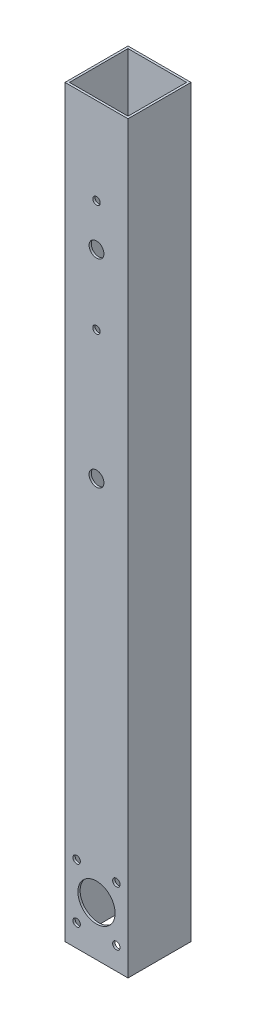
from build123d import *

# Parameters (mm, degrees)
SKETCH1_W           = 25.4
SKETCH1_H           = 25.4
SKETCH1_W_2         = 23.6
SKETCH1_H_2         = 23.6
BOSS_EXTRUDE1_DEPTH = 300
SKETCH2_R           = 7.5
CUT_EXTRUDE1_DEPTH  = 25.4
SKETCH3_R           = 3
CUT_EXTRUDE2_DEPTH  = 25.4
SKETCH4_R           = 1.5
CUT_EXTRUDE3_DEPTH  = 25.4
SKETCH5_R           = 1.5
CUT_EXTRUDE4_DEPTH  = 25.4


with BuildPart() as part:
    # Sketch1 → Boss-Extrude1 (new body)
    with BuildSketch(Plane(origin=(0, 0, 0), x_dir=(1, 0, 0), z_dir=(0, 1, 0))):
        Rectangle(SKETCH1_W, SKETCH1_H)
        Rectangle(SKETCH1_W_2, SKETCH1_H_2, mode=Mode.SUBTRACT)
    extrude(amount=BOSS_EXTRUDE1_DEPTH)

    # Sketch2 → Cut-Extrude1 (cut)
    with BuildSketch(Plane(origin=(0, 0, -12.7), x_dir=(-1, 0, 0), z_dir=(0, 0, -1))):
        with Locations((0, 20)):
            Circle(SKETCH2_R)
    extrude(amount=-CUT_EXTRUDE1_DEPTH, mode=Mode.SUBTRACT)

    # Sketch3 → Cut-Extrude2 (cut)
    with BuildSketch(Plane(origin=(0, 0, -12.7), x_dir=(-1, 0, 0), z_dir=(0, 0, -1))):
        with Locations((0, 168)):
            Circle(SKETCH3_R)
        with Locations((0, 248)):
            Circle(SKETCH3_R)
    extrude(amount=-CUT_EXTRUDE2_DEPTH, mode=Mode.SUBTRACT)

    # Sketch4 → Cut-Extrude3 (cut)
    with BuildSketch(Plane(origin=(0, 0, -12.7), x_dir=(-1, 0, 0), z_dir=(0, 0, -1))):
        with Locations((8, 9)):
            Circle(SKETCH4_R)
        with Locations((8, 31)):
            Circle(SKETCH4_R)
        with Locations((-8, 9)):
            Circle(SKETCH4_R)
        with Locations((-8, 31)):
            Circle(SKETCH4_R)
    extrude(amount=-CUT_EXTRUDE3_DEPTH, mode=Mode.SUBTRACT)

    # Sketch5 → Cut-Extrude4 (cut)
    with BuildSketch(Plane(origin=(0, 0, -12.7), x_dir=(-1, 0, 0), z_dir=(0, 0, -1))):
        with Locations((0, 220)):
            Circle(SKETCH5_R)
        with Locations((0, 265)):
            Circle(SKETCH5_R)
    extrude(amount=-CUT_EXTRUDE4_DEPTH, mode=Mode.SUBTRACT)


solid = part.part
